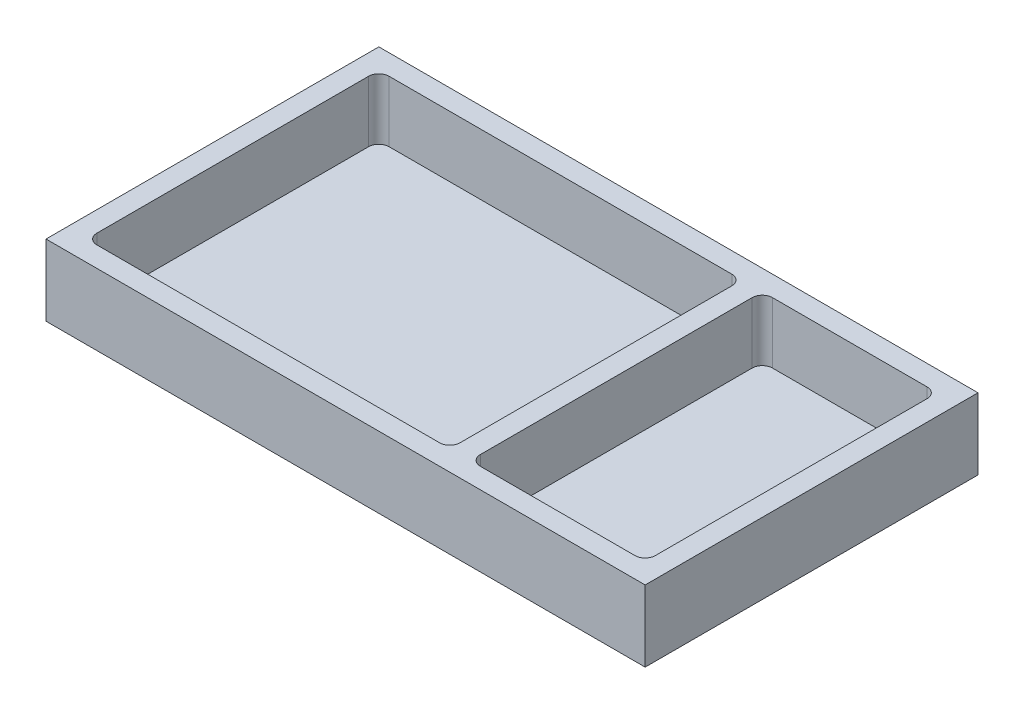
from build123d import *

# Parameters (mm, degrees)
SKETCH11_W     = 187.05178758
SKETCH11_H     = 103.91050065
EXTRUDE3_DEPTH = 19.05
SKETCH12_W     = 187.05178758
SKETCH12_H     = 103.91050065
EXTRUDE4_DEPTH = 3.175


with BuildPart() as part:
    # Sketch11 → Extrude3 (new body)
    with BuildSketch(Plane(origin=(0, 0, 0), x_dir=(1, 0, 0), z_dir=(0, 1, 0))):
        with Locations((93.52589379, 51.955250325)):
            Rectangle(SKETCH11_W, SKETCH11_H)
        with BuildLine():
            Line((9.525, 6.35), (116.541319734, 6.35))
            ThreePointArc((116.541319734, 6.35), (118.786383764, 7.27993597), (119.716319734, 9.525))
            Line((119.716319734, 9.525), (119.716319734, 94.38550065))
            ThreePointArc((119.716319734, 94.38550065), (118.786383764, 96.63056468), (116.541319734, 97.56050065))
            Line((116.541319734, 97.56050065), (9.525, 97.56050065))
            ThreePointArc((9.525, 97.56050065), (7.27993597, 96.63056468), (6.35, 94.38550065))
            Line((6.35, 94.38550065), (6.35, 9.525))
            ThreePointArc((6.35, 9.525), (7.27993597, 7.27993597), (9.525, 6.35))
        make_face(mode=Mode.SUBTRACT)
        with BuildLine():
            Line((180.70178758, 9.525), (180.70178758, 94.38550065))
            ThreePointArc((180.70178758, 94.38550065), (179.77185161, 96.63056468), (177.52678758, 97.56050065))
            Line((177.52678758, 97.56050065), (129.241319734, 97.56050065))
            ThreePointArc((129.241319734, 97.56050065), (126.996255703, 96.63056468), (126.066319734, 94.38550065))
            Line((126.066319734, 94.38550065), (126.066319734, 9.525))
            ThreePointArc((126.066319734, 9.525), (126.996255703, 7.27993597), (129.241319734, 6.35))
            Line((129.241319734, 6.35), (177.52678758, 6.35))
            ThreePointArc((177.52678758, 6.35), (179.77185161, 7.27993597), (180.70178758, 9.525))
        make_face(mode=Mode.SUBTRACT)
    extrude(amount=EXTRUDE3_DEPTH)

    # Sketch12 → Extrude4 (add)
    with BuildSketch(Plane(origin=(0, 0, 0), x_dir=(1, 0, 0), z_dir=(0, 1, 0))):
        with Locations((93.52589379, 51.955250325)):
            Rectangle(SKETCH12_W, SKETCH12_H)
    extrude(amount=-EXTRUDE4_DEPTH)


solid = part.part
